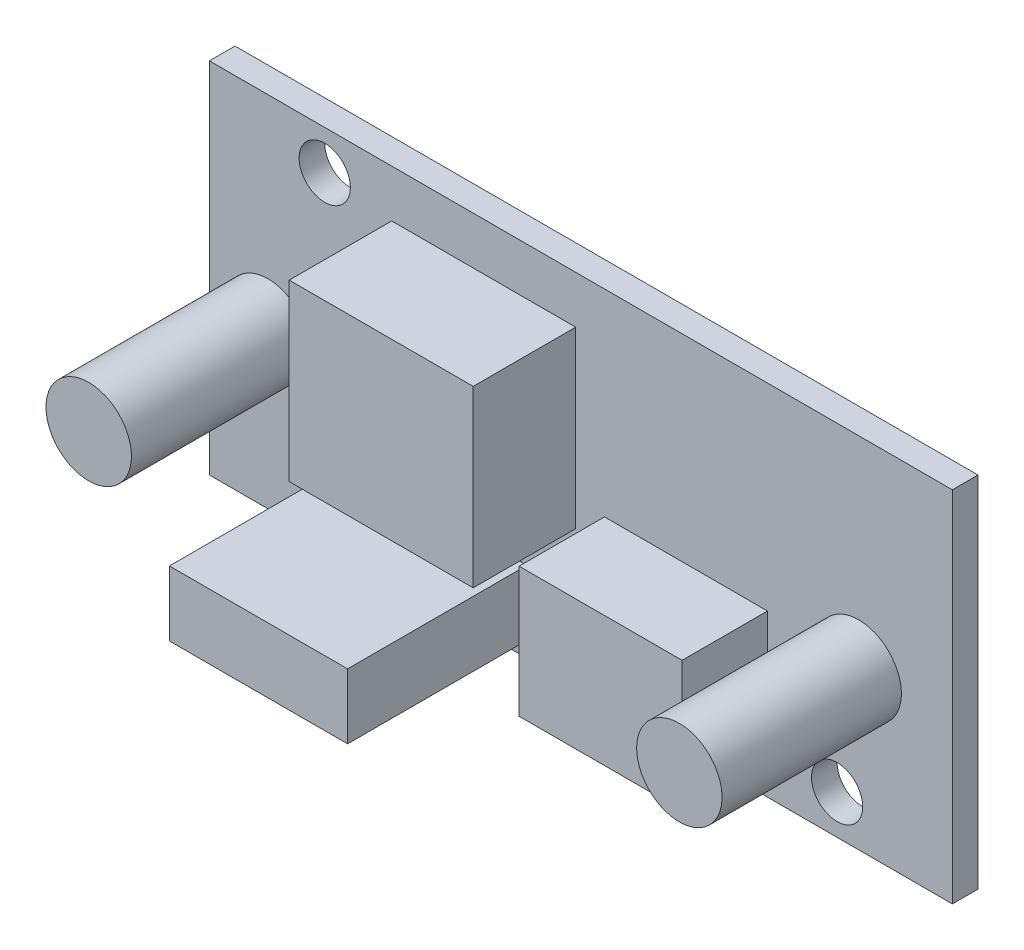
from build123d import *

# Parameters (mm, degrees)
SKETCH1_W           = 43.5
SKETCH1_H           = 21
SKETCH1_R           = 1.5
BOSS_EXTRUDE1_DEPTH = 1.5
SKETCH2_R           = 2.5
SKETCH2_W           = 10.433244148
SKETCH2_H           = 3.805065513
BOSS_EXTRUDE2_DEPTH = 10.5
SKETCH3_W           = 10.770790281
SKETCH3_H           = 10.218442062
BOSS_EXTRUDE3_DEPTH = 6
SKETCH4_W           = 9.543349793
SKETCH4_H           = 7.610131025
BOSS_EXTRUDE4_DEPTH = 5


with BuildPart() as part:
    # Sketch1 → Boss-Extrude1 (new body)
    with BuildSketch(Plane.XY):
        with Locations((21.75, 10.5)):
            Rectangle(SKETCH1_W, SKETCH1_H)
        with Locations((6.75, 18.7)):
            Circle(SKETCH1_R, mode=Mode.SUBTRACT)
        with Locations((36.75, 2.3)):
            Circle(SKETCH1_R, mode=Mode.SUBTRACT)
    extrude(amount=BOSS_EXTRUDE1_DEPTH)

    # Sketch2 → Boss-Extrude2 (add)
    with BuildSketch(Plane.XY.offset(1.5)):
        with Locations(Location((3.430450718, 9.165158469, 0), (0, 0, 180))):
            Circle(SKETCH2_R)
        with Locations(Location((38.013586465, 9.165158469, 0), (0, 0, 180))):
            Circle(SKETCH2_R)
        with Locations((13.37271867, 2.813153945)):
            Rectangle(SKETCH2_W, SKETCH2_H)
    extrude(amount=BOSS_EXTRUDE2_DEPTH)

    # Sketch3 → Boss-Extrude3 (add)
    with BuildSketch(Plane.XY.offset(1.5)):
        with Locations((16.057744738, 13.108311037)):
            Rectangle(SKETCH3_W, SKETCH3_H)
    extrude(amount=BOSS_EXTRUDE3_DEPTH)

    # Sketch4 → Boss-Extrude4 (add)
    with BuildSketch(Plane.XY.offset(1.5)):
        with Locations((27.902545446, 5.636267067)):
            Rectangle(SKETCH4_W, SKETCH4_H)
    extrude(amount=BOSS_EXTRUDE4_DEPTH)


solid = part.part
